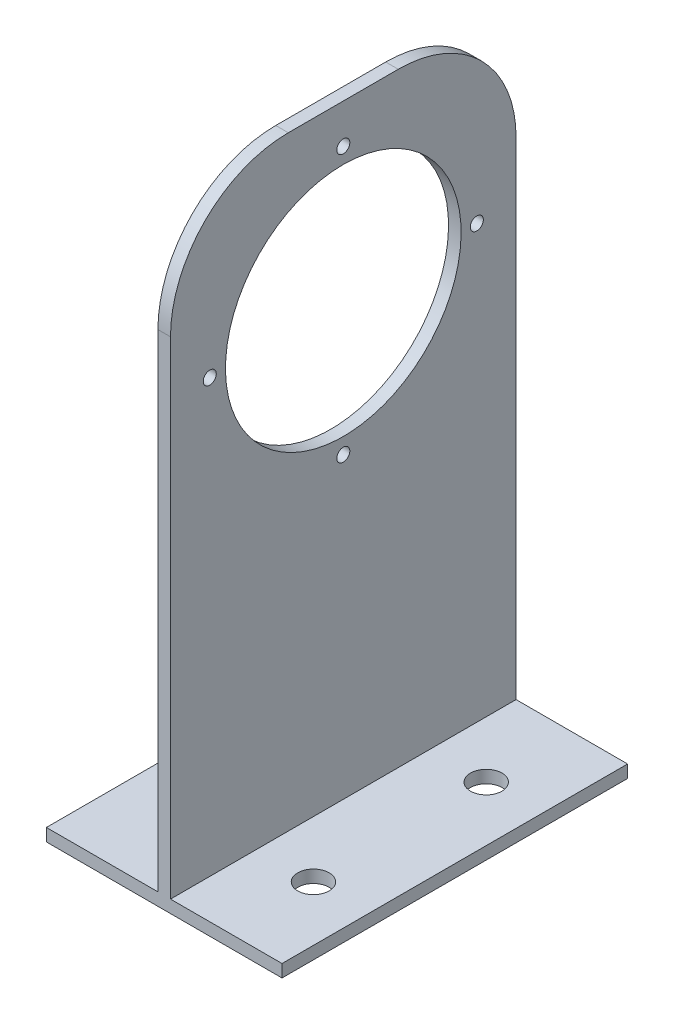
from build123d import *

# Parameters (mm, degrees)
BOSS_EXTRUDE1_DEPTH     = 220
F_20_0MM_DOWEL_HOLE1_D  = 20
FILLET1_R               = 75
SKETCH4_R               = 75
CUT_EXTRUDE1_DEPTH      = 458.263600126
F_8_0_MM_DOWEL_HOLES1_D = 8.3


with BuildPart() as part:
    # Sketch1 → Boss-Extrude1 (new body)
    with BuildSketch(Plane.XY):
        Polygon((-4, 393), (-4, 8), (-75, 8), (-75, 0), (75, 0), (75, 8), (4, 8), (4, 393), align=None)
    extrude(amount=BOSS_EXTRUDE1_DEPTH)

    # Ø20.0mm Dowel Hole1 (through all)
    with Locations(Plane(origin=(0, 0, 0), x_dir=(-1, 0, 0), z_dir=(0, -1, 0))):
        with Locations((-40, -55), (-40, -165), (40, -165), (40, -55)):
            Hole(F_20_0MM_DOWEL_HOLE1_D / 2)

    # Fillet1
    fillet1_edges = [part.edges().sort_by_distance(p)[0] for p in [
        (0, 393, 0),
        (0, 393, 220),
    ]]
    fillet(fillet1_edges, radius=FILLET1_R)

    # Sketch4 → Cut-Extrude1 (cut, through all)
    with BuildSketch(Plane(origin=(4, 0, 0), x_dir=(0, 0, -1), z_dir=(1, 0, 0))):
        with Locations(Location((-110, 283, 0), (0, 0, 90))):
            Circle(SKETCH4_R)
    extrude(amount=-CUT_EXTRUDE1_DEPTH, mode=Mode.SUBTRACT)

    # Ø8.0 mm Dowel Holes1 (through all)
    with Locations(Plane(origin=(4, 0, 0), x_dir=(0, 0, -1), z_dir=(1, 0, 0))):
        with Locations((-110, 368), (-195, 283), (-110, 198), (-25, 283)):
            Hole(F_8_0_MM_DOWEL_HOLES1_D / 2)


solid = part.part
